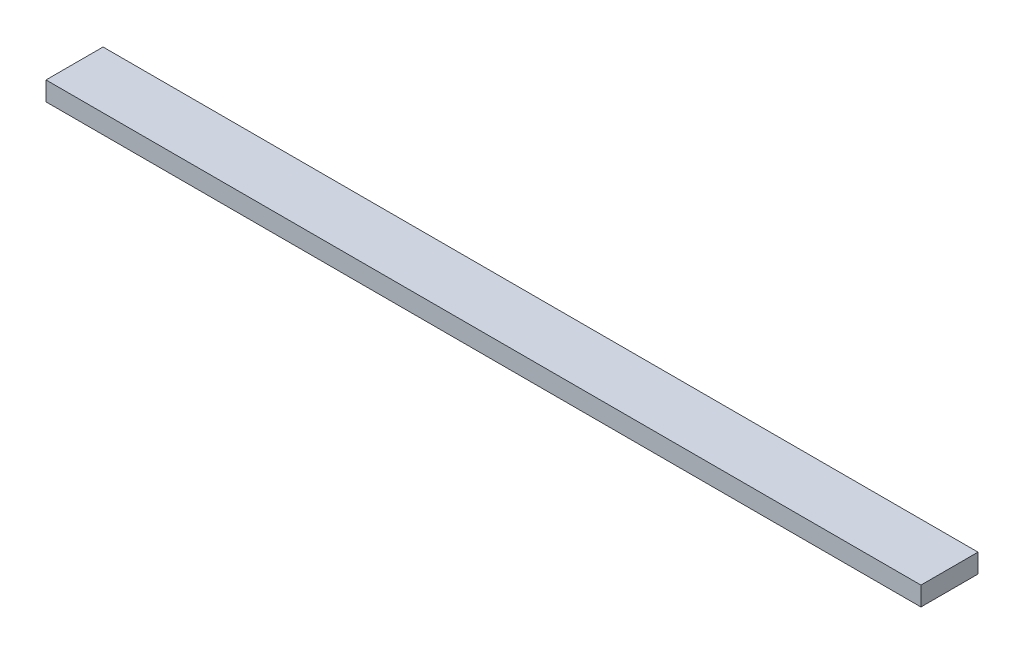
from build123d import *

# Parameters (mm, degrees)
SKETCH1_W           = 2300
SKETCH1_H           = 150
BOSS_EXTRUDE1_DEPTH = 50


with BuildPart() as part:
    # Sketch1 → Boss-Extrude1 (new body)
    with BuildSketch(Plane(origin=(0, 0, 0), x_dir=(1, 0, 0), z_dir=(0, 1, 0))):
        with Locations((1150, 75)):
            Rectangle(SKETCH1_W, SKETCH1_H)
    extrude(amount=BOSS_EXTRUDE1_DEPTH)


solid = part.part
